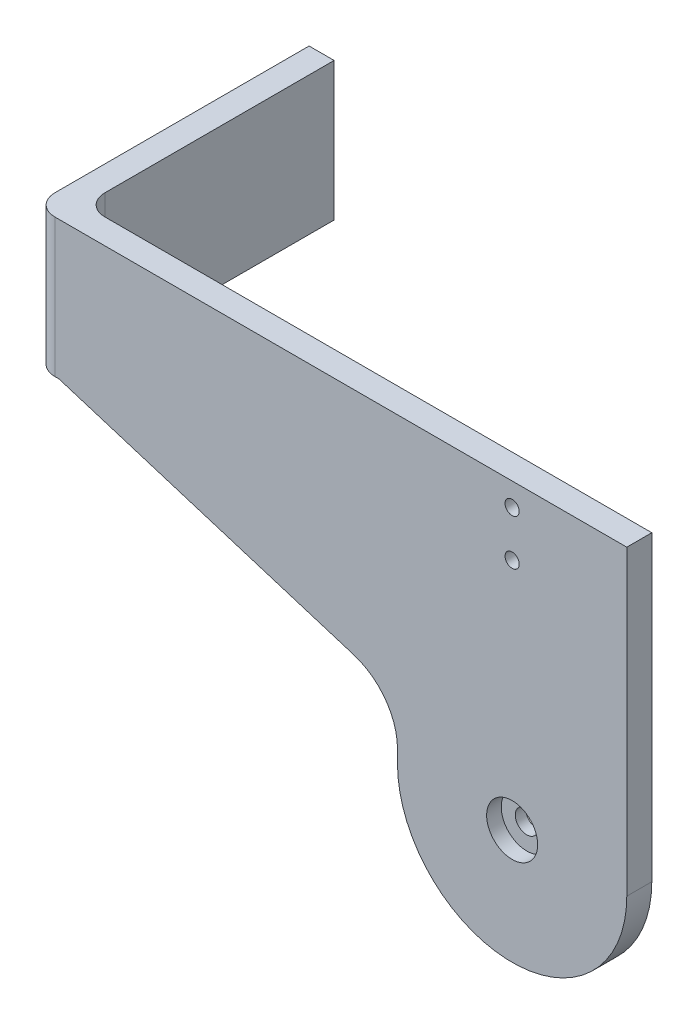
from build123d import *

# Parameters (mm, degrees)
ESTRUSIONE_ESTRUSIONE1_DEPTH                         = 6
SCHIZZO3_W                                           = 136.2
SCHIZZO3_H                                           = 72.5
ESTRUSIONE_ESTRUSIONE2_DEPTH                         = 6
TAGLIO_ESTRUSIONE1_DEPTH                             = 131.797324132
RACCORDO5_R                                          = 15
ESTRUSIONE_ESTRUSIONE5_DEPTH                         = 6
ESTRUSIONE_ESTRUSIONE5_DEPTH_BACK                    = 60
SCHIZZO9_W                                           = 6
SCHIZZO9_H                                           = 33.15279029
RACCORDO6_R                                          = 5
RACCORDO7_R                                          = 5
FORO_LAMATO_PER_BULLONE_M3_A_TESTA_E_2_COUNT         = 2
FORO_LAMATO_PER_BULLONE_M3_A_TESTA_E_2_PITCH         = 10.95
FORO_LAMATO_PER_BULLONE_M5_A_TESTA_ESAGO_D           = 5.5
FORO_LAMATO_PER_BULLONE_M5_A_TESTA_ESAGO_CBORE_D     = 12.238
FORO_LAMATO_PER_BULLONE_M5_A_TESTA_ESAGO_CBORE_DEPTH = 3.5


with BuildPart() as part:
    # Schizzo2 → Estrusione-Estrusione1 (new body)
    with BuildSketch(Plane.XY):
        with BuildLine():
            Line((-27.5, 0), (-27.5, 45))
            ThreePointArc((-27.5, 45), (0, 72.5), (27.5, 45))
            Line((27.5, 45), (27.5, 0))
            ThreePointArc((27.5, 0), (0, -27.5), (-27.5, 0))
        make_face()
    extrude(amount=ESTRUSIONE_ESTRUSIONE1_DEPTH)

    # Schizzo3 → Estrusione-Estrusione2 (add)
    with BuildSketch(Plane.XY):
        with Locations((-40.6, 36.25)):
            Rectangle(SCHIZZO3_W, SCHIZZO3_H)
    extrude(amount=ESTRUSIONE_ESTRUSIONE2_DEPTH)

    # Schizzo4 → Taglio-Estrusione1 (cut, through all)
    with BuildSketch(Plane.XY.offset(6)):
        Polygon((-27.5, 0), (-108.7, 0), (-108.7, 39.34720971), (-27.5, 14.142426235), align=None)
    extrude(amount=-TAGLIO_ESTRUSIONE1_DEPTH, mode=Mode.SUBTRACT)

    # Raccordo5
    raccordo5_edges = [part.edges().sort_by_distance(p)[0] for p in [
        (-27.5, 14.142426235, 3),
    ]]
    fillet(raccordo5_edges, radius=RACCORDO5_R)

    # Schizzo9 → Estrusione-Estrusione5 (add, two sides: drawn at the far end of the back side and taken through both)
    with BuildSketch(Plane.XY.offset(-ESTRUSIONE_ESTRUSIONE5_DEPTH_BACK)):
        with Locations((-111.7, 55.923604855)):
            Rectangle(SCHIZZO9_W, SCHIZZO9_H)
    extrude(amount=ESTRUSIONE_ESTRUSIONE5_DEPTH + ESTRUSIONE_ESTRUSIONE5_DEPTH_BACK)

    # Raccordo6
    raccordo6_edges = [part.edges().sort_by_distance(p)[0] for p in [
        (-108.7, 55.923604855, 0),
    ]]
    fillet(raccordo6_edges, radius=RACCORDO6_R)

    # Raccordo7
    raccordo7_edges = [part.edges().sort_by_distance(p)[0] for p in [
        (-114.7, 55.923604855, 6),
    ]]
    fillet(raccordo7_edges, radius=RACCORDO7_R)

    # Schizzo20 → Foro lamato per Bullone M3 a testa esagonale-3 (revolve, cut)
    with BuildSketch(Plane(origin=(0, 67, 0), x_dir=(0, 1, 0), z_dir=(1, 0, 0))):
        Polygon((0, 0), (0, 6), (1.7, 6), (1.7, 0.5), (4.5, 0.5), (4.5, 0.025), (4.525, 0), align=None)
    foro_lamato_per_bullone_m3_a_testa_esago = revolve(axis=Axis((0, 67, -6.35), (0, 0, 1)), mode=Mode.SUBTRACT)

    # Foro lamato per Bullone M3 a testa e 2: Foro lamato per Bullone M3 a testa esagonale-3 ×2
    with Locations(*[(0, -i * FORO_LAMATO_PER_BULLONE_M3_A_TESTA_E_2_PITCH, 0) for i in range(1, FORO_LAMATO_PER_BULLONE_M3_A_TESTA_E_2_COUNT)]):
        add(foro_lamato_per_bullone_m3_a_testa_esago, mode=Mode.SUBTRACT)

    # Foro lamato per Bullone M5 a testa esagonale-1 (through all)
    with Locations(Plane.XY.offset(6)):
        with Locations((0, 0)):
            CounterBoreHole(FORO_LAMATO_PER_BULLONE_M5_A_TESTA_ESAGO_D / 2, FORO_LAMATO_PER_BULLONE_M5_A_TESTA_ESAGO_CBORE_D / 2, FORO_LAMATO_PER_BULLONE_M5_A_TESTA_ESAGO_CBORE_DEPTH)


solid = part.part
